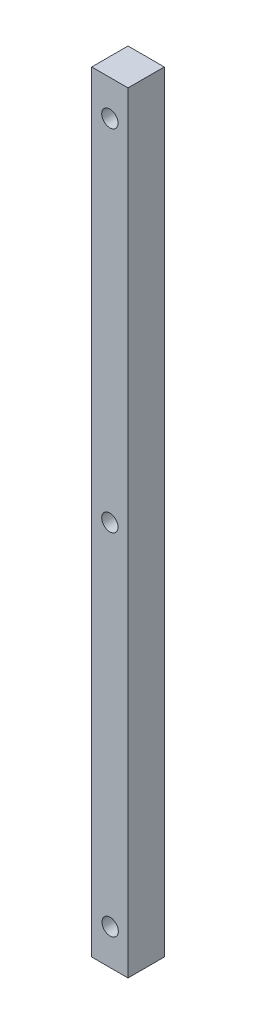
from build123d import *

# Parameters (mm, degrees)
SKETCH1_W           = 5.079991364
SKETCH1_H           = 107.95
BOSS_EXTRUDE1_DEPTH = 5.08
CUT_EXTRUDE1_REACH  = 103.848
SKETCH3_R           = 1.143


with BuildPart() as part:
    # Sketch1 → Boss-Extrude1 (new body)
    with BuildSketch(Plane.XY):
        with Locations((-0.039375527, -47.713604651)):
            Rectangle(SKETCH1_W, SKETCH1_H)
    extrude(amount=BOSS_EXTRUDE1_DEPTH)

    # Sketch3 → Cut-Extrude1 (cut, up to next)
    with BuildSketch(Plane.XY.offset(5.08), mode=Mode.PRIVATE) as cut_extrude1_sk1:
        with Locations((-0.039375527, -47.713604651)):
            Circle(SKETCH3_R)
    cut_extrude1_tool1 = extrude(cut_extrude1_sk1.sketch, amount=-CUT_EXTRUDE1_REACH, mode=Mode.PRIVATE) & part.part
    # Sketch3 → Cut-Extrude1 (cut, up to next)
    with BuildSketch(Plane.XY.offset(5.08), mode=Mode.PRIVATE) as cut_extrude1_sk2:
        with Locations((-0.039375527, 1.286395349)):
            Circle(SKETCH3_R)
    cut_extrude1_tool2 = extrude(cut_extrude1_sk2.sketch, amount=-CUT_EXTRUDE1_REACH, mode=Mode.PRIVATE) & part.part
    # Sketch3 → Cut-Extrude1 (cut, up to next)
    with BuildSketch(Plane.XY.offset(5.08), mode=Mode.PRIVATE) as cut_extrude1_sk3:
        with Locations((0, -96.713604651)):
            Circle(SKETCH3_R)
    cut_extrude1_tool3 = extrude(cut_extrude1_sk3.sketch, amount=-CUT_EXTRUDE1_REACH, mode=Mode.PRIVATE) & part.part
    add(cut_extrude1_tool1.solids().sort_by_distance((-0.039376, -47.713605, 5.08))[0], mode=Mode.SUBTRACT)
    add(cut_extrude1_tool2.solids().sort_by_distance((-0.039376, 1.286395, 5.08))[0], mode=Mode.SUBTRACT)
    add(cut_extrude1_tool3.solids().sort_by_distance((0, -96.713605, 5.08))[0], mode=Mode.SUBTRACT)


solid = part.part
